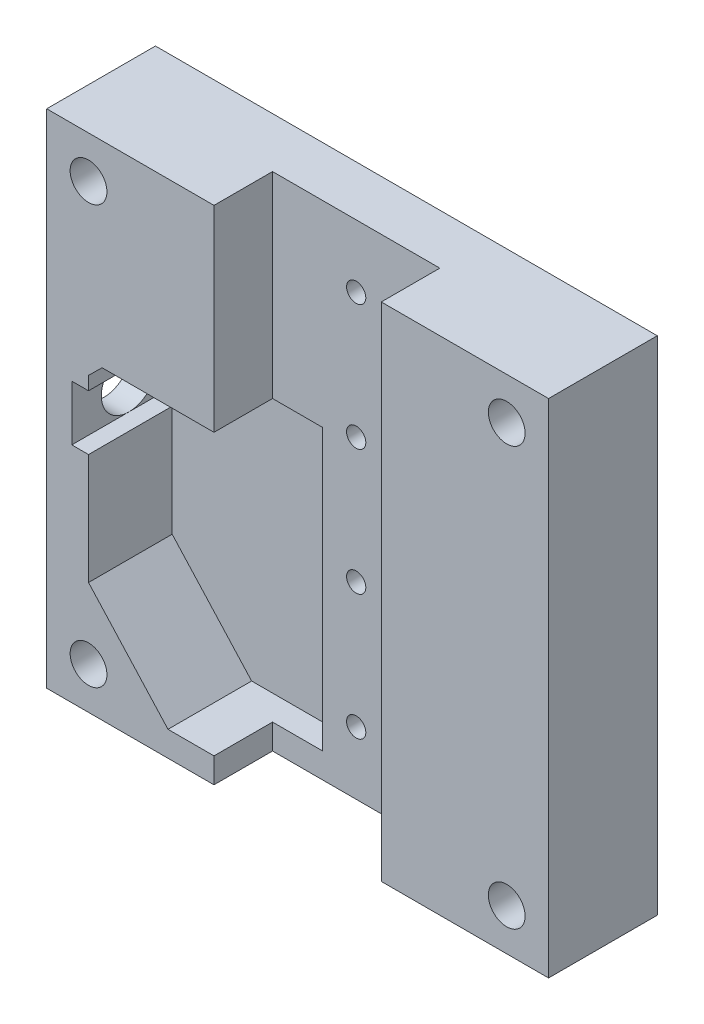
from build123d import *

# Parameters (mm, degrees)
SKETCH1_W           = 60
SKETCH1_H           = 60
BOSS_EXTRUDE1_DEPTH = 6
CUT_EXTRUDE2_DEPTH  = 3
SKETCH12_R          = 1.15
CUT_EXTRUDE9_DEPTH  = 43.848570571
SKETCH5_W           = 20
SKETCH5_H           = 60
BOSS_EXTRUDE2_DEPTH = 7
SKETCH6_R           = 1.15
CUT_EXTRUDE4_DEPTH  = 45.373415465
SKETCH8_R           = 2.2
SKETCH8_R_2         = 1.15
CUT_EXTRUDE5_DEPTH  = 9
CUT_EXTRUDE6_DEPTH  = 10
SKETCH10_W          = 6
SKETCH10_H          = 33.5
CUT_EXTRUDE7_DEPTH  = 3
CUT_EXTRUDE8_DEPTH  = 66.711490624


with BuildPart() as part:
    # Sketch1 → Boss-Extrude1 (new body)
    with BuildSketch(Plane.XY):
        Rectangle(SKETCH1_W, SKETCH1_H)
    extrude(amount=BOSS_EXTRUDE1_DEPTH)

    # Sketch3 → Cut-Extrude2 (cut)
    with BuildSketch(Plane(origin=(0, 0, 0), x_dir=(-1, 0, 0), z_dir=(0, 0, -1))):
        Polygon((2.1, 6.287564435), (2.1, 8.712435565), (0, 9.924871131), (-2.1, 8.712435565), (-2.1, 6.287564435), (0, 5.075128869), align=None)
        Polygon((2.1, -8.712435565), (2.1, -6.287564435), (0, -5.075128869), (-2.1, -6.287564435), (-2.1, -8.712435565), (0, -9.924871131), align=None)
        Polygon((2.1, -23.712435565), (2.1, -21.287564435), (0, -20.075128869), (-2.1, -21.287564435), (-2.1, -23.712435565), (0, -24.924871131), align=None)
        Polygon((0, 20.075128869), (2.1, 21.287564435), (2.1, 23.712435565), (0, 24.924871131), (-2.1, 23.712435565), (-2.1, 21.287564435), align=None)
    extrude(amount=-CUT_EXTRUDE2_DEPTH, mode=Mode.SUBTRACT)

    # Sketch12 → Cut-Extrude9 (cut, through all)
    with BuildSketch(Plane(origin=(0, 0, 0), x_dir=(-1, 0, 0), z_dir=(0, 0, -1))):
        with Locations((0, 22.5)):
            Circle(SKETCH12_R)
        with Locations((0, 7.5)):
            Circle(SKETCH12_R)
        with Locations((0, -7.5)):
            Circle(SKETCH12_R)
        with Locations((0, -22.5)):
            Circle(SKETCH12_R)
    extrude(amount=-CUT_EXTRUDE9_DEPTH, mode=Mode.SUBTRACT)

    # Sketch5 → Boss-Extrude2 (add)
    with BuildSketch(Plane.XY.offset(6)):
        with Locations((-20, 0)):
            Rectangle(SKETCH5_W, SKETCH5_H)
        with Locations((20, 0)):
            Rectangle(SKETCH5_W, SKETCH5_H)
    extrude(amount=BOSS_EXTRUDE2_DEPTH)

    # Sketch6 → Cut-Extrude4 (cut, through all)
    with BuildSketch(Plane.XY.offset(13)):
        with Locations((-25, 25)):
            Circle(SKETCH6_R)
        with Locations((25, 25)):
            Circle(SKETCH6_R)
        with Locations((25, -25)):
            Circle(SKETCH6_R)
        with Locations((-25, -25)):
            Circle(SKETCH6_R)
    extrude(amount=-CUT_EXTRUDE4_DEPTH, mode=Mode.SUBTRACT)

    # Sketch8 → Cut-Extrude5 (cut)
    # profile 1 of 4: a face of its own
    with BuildSketch(Plane.XY.offset(13)):
        with Locations((-25, 25)):
            Circle(SKETCH8_R)
        with Locations((-25, 25)):
            Circle(SKETCH8_R_2, mode=Mode.SUBTRACT)
    # profile 2 of 4: a face of its own
    with BuildSketch(Plane.XY.offset(13)):
        with Locations((25, 25)):
            Circle(SKETCH8_R)
    # profile 3 of 4: a face of its own
    with BuildSketch(Plane.XY.offset(13)):
        with Locations((25, -25)):
            Circle(SKETCH8_R)
    # profile 4 of 4: a face of its own
    with BuildSketch(Plane.XY.offset(13)):
        with Locations((-25, -25)):
            Circle(SKETCH8_R)
        with Locations((-25, -25)):
            Circle(SKETCH8_R_2, mode=Mode.SUBTRACT)
    extrude(amount=-CUT_EXTRUDE5_DEPTH, mode=Mode.SUBTRACT)

    # Sketch9 → Cut-Extrude6 (cut)
    with BuildSketch(Plane.XY.offset(13)):
        Polygon((-25, -16.55), (-15.5, -27), (-10, -27), (-10, 6.5), (-23.375, 6.5), (-25, 4.9), (-25, 3.3), (-27, 3.3), (-27, -3.3), (-25, -3.3), align=None)
    extrude(amount=-CUT_EXTRUDE6_DEPTH, mode=Mode.SUBTRACT)

    # Sketch10 → Cut-Extrude7 (cut)
    with BuildSketch(Plane.XY.offset(6)):
        with Locations((-7, -10.25)):
            Rectangle(SKETCH10_W, SKETCH10_H)
    extrude(amount=-CUT_EXTRUDE7_DEPTH, mode=Mode.SUBTRACT)

    # Sketch11 → Cut-Extrude8 (cut, through all)
    with BuildSketch(Plane(origin=(-27, 0, 0), x_dir=(0, 0, -1), z_dir=(1, 0, 0))):
        with BuildLine():
            Line((-3, -0.899652711), (-3, 0.899652711))
            ThreePointArc((-3, 0.899652711), (-9.475, 0), (-3, -0.899652711))
        make_face()
    extrude(amount=-CUT_EXTRUDE8_DEPTH, mode=Mode.SUBTRACT)


solid = part.part
